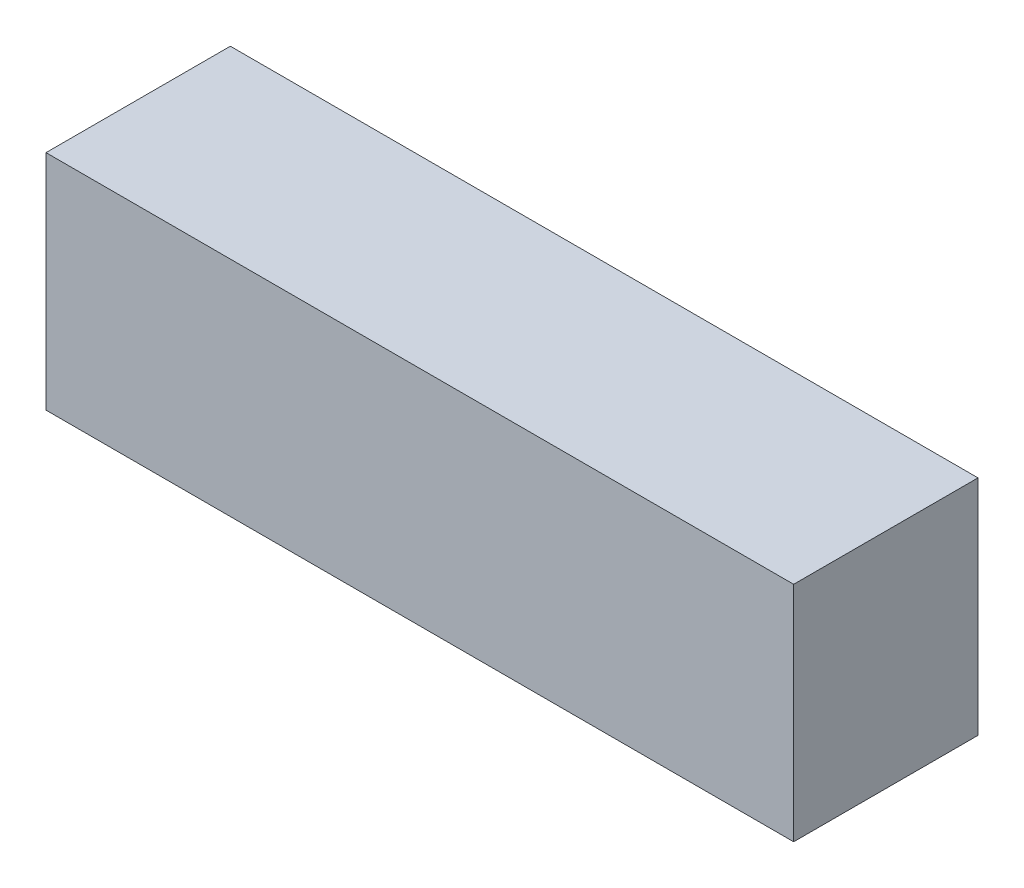
from build123d import *

# Parameters (mm, degrees)
SKETCH1_W           = 147.32
SKETCH1_H           = 43.942
BOSS_EXTRUDE1_DEPTH = 36.322


with BuildPart() as part:
    # Sketch1 → Boss-Extrude1 (new body)
    with BuildSketch(Plane.XY):
        with Locations((73.66, 21.971)):
            Rectangle(SKETCH1_W, SKETCH1_H)
    extrude(amount=BOSS_EXTRUDE1_DEPTH)


solid = part.part
